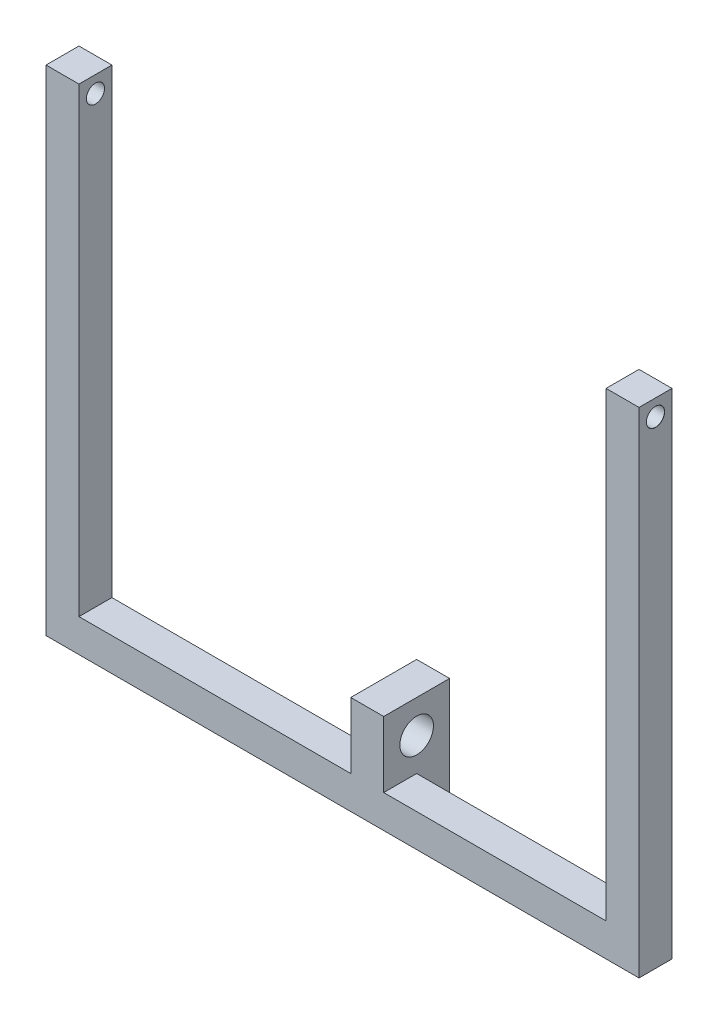
from build123d import *

# Parameters (mm, degrees)
SKETCH1_W                      = 180
SKETCH1_H                      = 10
BOSS_EXTRUDE1_DEPTH            = 10
SKETCH2_W                      = 10
SKETCH2_H                      = 10
BOSS_EXTRUDE2_DEPTH            = 140
M5_CLEARANCE_HOLE1_D           = 5.5
M5_CLEARANCE_HOLE1_CSINK_D     = 5.55
M5_CLEARANCE_HOLE1_CSINK_ANGLE = 90
BOSS_EXTRUDE3_START            = 2.5
BOSS_EXTRUDE3_DEPTH            = 10
HOLE1_D                        = 10.2
HOLE1_DEPTH                    = 10
HOLE1_CBORE_D                  = 11.4
HOLE1_CBORE_DEPTH              = 0.6


with BuildPart() as part:
    # Sketch1 → Boss-Extrude1 (new body)
    with BuildSketch(Plane(origin=(0, 0, 0), x_dir=(1, 0, 0), z_dir=(0, 1, 0))):
        Rectangle(SKETCH1_W, SKETCH1_H)
    extrude(amount=BOSS_EXTRUDE1_DEPTH)

    # Sketch2 → Boss-Extrude2 (add)
    with BuildSketch(Plane(origin=(0, 10, 0), x_dir=(1, 0, 0), z_dir=(0, 1, 0))):
        with Locations((-85, 0)):
            Rectangle(SKETCH2_W, SKETCH2_H)
        with Locations((85, 0)):
            Rectangle(SKETCH2_W, SKETCH2_H)
    extrude(amount=BOSS_EXTRUDE2_DEPTH)

    # M5 Clearance Hole1 (through all)
    with Locations(Plane(origin=(90, 0, 0), x_dir=(0, 0, -1), z_dir=(1, 0, 0))):
        with Locations((0, 145)):
            CounterSinkHole(M5_CLEARANCE_HOLE1_D / 2, M5_CLEARANCE_HOLE1_CSINK_D / 2, counter_sink_angle=M5_CLEARANCE_HOLE1_CSINK_ANGLE)

    # Sketch6 → Boss-Extrude3 (add)
    with BuildSketch(Plane(origin=(0, 0, 0), x_dir=(0, 0, -1), z_dir=(1, 0, 0)).offset(BOSS_EXTRUDE3_START)):
        Polygon((5, 0), (5, 10), (-5, 10), (-5, 30), (15, 30), (15, 0), align=None)
    extrude(amount=BOSS_EXTRUDE3_DEPTH)

    # Hole1
    with Locations(Plane.ZY.offset(-2.5)):
        with Locations((-5, 20)):
            CounterBoreHole(HOLE1_D / 2, HOLE1_CBORE_D / 2, HOLE1_CBORE_DEPTH, depth=HOLE1_DEPTH)


solid = part.part
